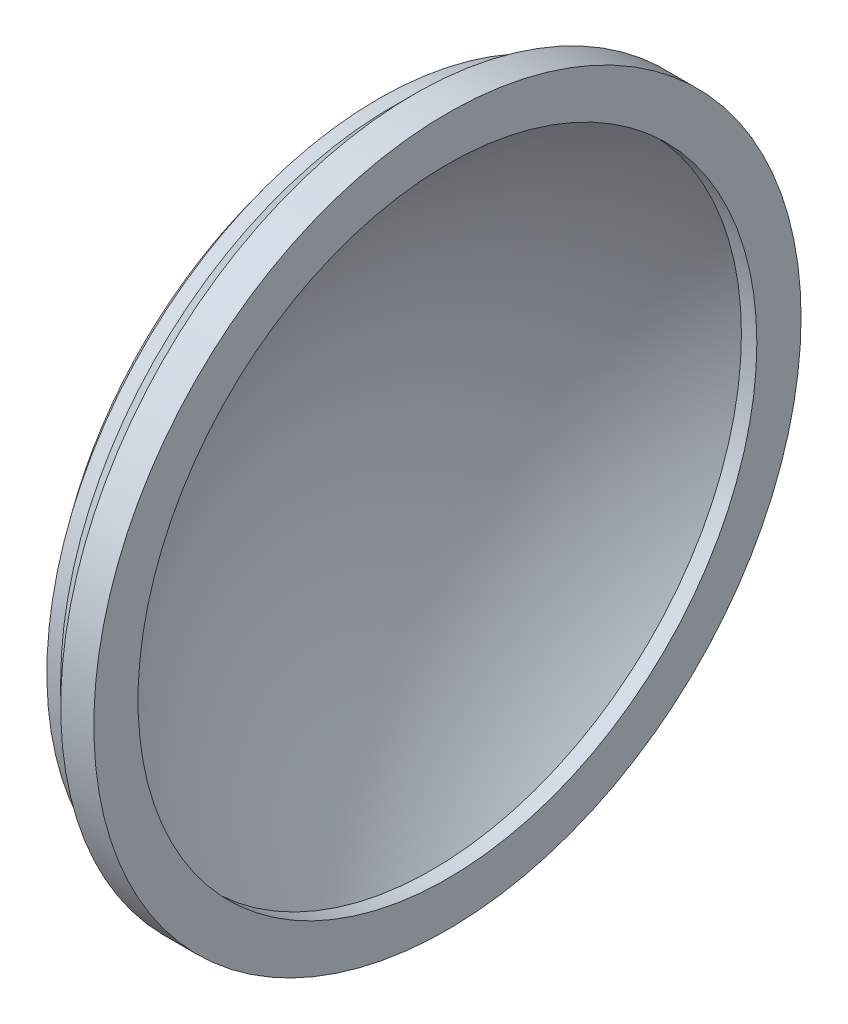
from build123d import *


with BuildPart() as part:
    # Sketch1 → Revolve1 (revolve)
    with BuildSketch(Plane.XY, mode=Mode.PRIVATE) as revolve1_sk:
        with BuildLine():
            Line((-28.5, 60), (-26, 60))
            Line((-26, 60), (-22, 64))
            Line((-22, 64), (-16, 64))
            Line((-16, 64), (-16, 56))
            Line((-16, 56), (-18.790689802, 56))
            ThreePointArc((-18.790689802, 56), (-34.407796248, 29.913629212), (-39.845400687, 0))
            Line((-39.845400687, 0), (-49.845400687, 0))
            ThreePointArc((-49.845400687, 0), (-44.350112671, 31.841899011), (-28.5, 60))
        make_face()
    revolve(revolve1_sk.sketch.rotate(Axis((87.41051008, 0, 0), (-1, 0, 0)), 90), axis=Axis((87.41051008, 0, 0), (-1, 0, 0)))


solid = part.part
